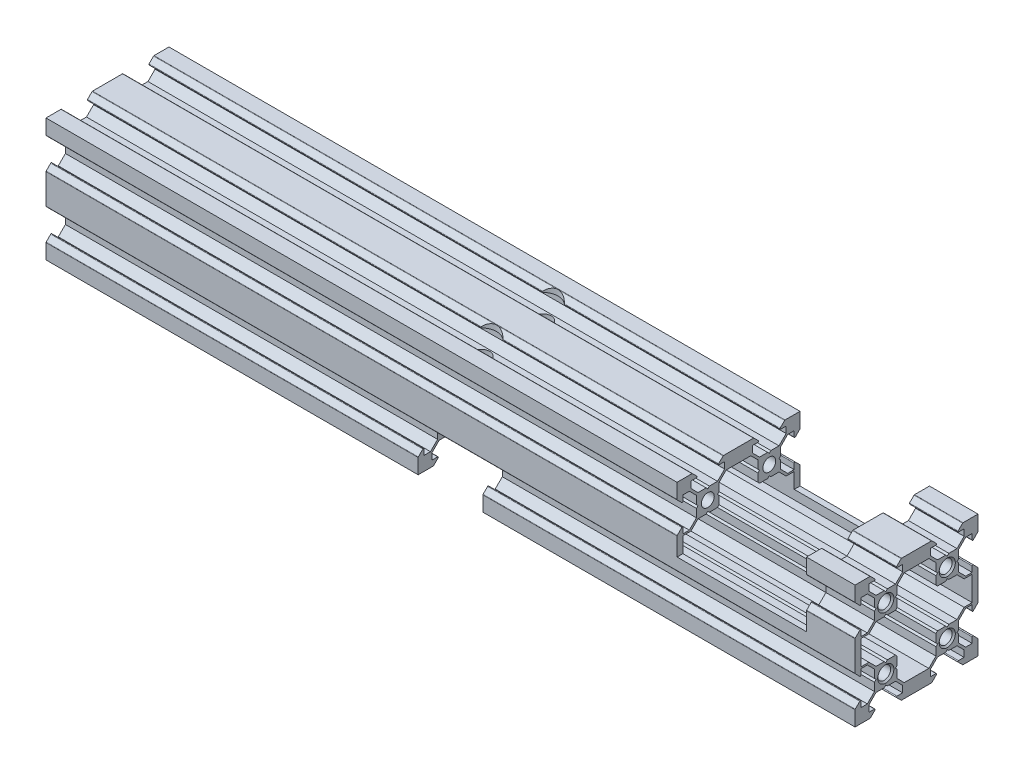
from build123d import *

# Parameters (mm, degrees)
MAIN_BODY_DEPTH               = 125
MAIN_BODY_DEPTH_BACK          = 125
SKETCH2_R                     = 2
CHAMFER1_SIZE                 = 0.5
CHAMFER2_SIZE                 = 0.5
CHAMFER3_SIZE                 = 0.5
TOP_HOLES_DEPTH               = 132.336275853
TOP_HOLES_DEPTH_BACK          = 132.336275853
SKETCH5_R                     = 2.6
TOP_HOLE_CLEARANCE_DEPTH      = 134.71932335
TOP_HOLE_CLEARANCE_DEPTH_BACK = 3
SKETCH6_R                     = 4.75
CUT_EXTRUDE5_DEPTH            = 132.336275948
CUT_EXTRUDE5_DEPTH_BACK       = 132.336275948
SKETCH7_W                     = 20
SKETCH7_H                     = 9.499173517
SKETCH7_W_2                   = 40
SKETCH7_H_2                   = 20


with BuildPart() as part:
    # Sketch2 → Main Body (new, two sides: drawn at the far end of the back side and taken through both)
    with BuildSketch(Plane(origin=(0, 0, 0), x_dir=(0, 0, -1), z_dir=(1, 0, 0)).offset(-MAIN_BODY_DEPTH_BACK)):
        with BuildLine():
            Line((0.5, 3.5), (0, 3))
            Line((0, 3), (-0.5, 3.5))
            Line((-0.5, 3.5), (-3.01, 3.5))
            Line((-3.01, 3.5), (-5.209102089, 5.699102089))
            Line((-5.209102089, 5.699102089), (-5.209102089, 7.699102089))
            Line((-5.209102089, 7.699102089), (-3.479102089, 7.699102089))
            ThreePointArc((-3.479102089, 7.699102089), (-3.294326183, 7.822565403), (-3.337680733, 8.040523446))
            Line((-3.337680733, 8.040523446), (-4.73775216, 9.440594872))
            ThreePointArc((-4.73775216, 9.440594872), (-4.80263683, 9.483949423), (-4.879173516, 9.499173516))
            Line((-4.879173516, 9.499173516), (-9.499173516, 9.499173516))
            Line((-9.499173516, 9.499173516), (-9.499173516, 4.879173516))
            ThreePointArc((-9.499173516, 4.879173516), (-9.483949423, 4.80263683), (-9.440594872, 4.73775216))
            Line((-9.440594872, 4.73775216), (-8.040523446, 3.337680733))
            ThreePointArc((-8.040523446, 3.337680733), (-7.822565403, 3.294326183), (-7.699102089, 3.479102089))
            Line((-7.699102089, 3.479102089), (-7.699102089, 5.209102089))
            Line((-7.699102089, 5.209102089), (-5.699102089, 5.209102089))
            Line((-5.699102089, 5.209102089), (-3.5, 3.01))
            Line((-3.5, 3.01), (-3.5, 0.5))
            Line((-3.5, 0.5), (-3, 0))
            Line((-3, 0), (-3.5, -0.5))
            Line((-3.5, -0.5), (-3.5, -3.01))
            Line((-3.5, -3.01), (-5.699102089, -5.209102089))
            Line((-5.699102089, -5.209102089), (-7.699102089, -5.209102089))
            Line((-7.699102089, -5.209102089), (-7.699102089, -3.479102089))
            ThreePointArc((-7.699102089, -3.479102089), (-7.822565403, -3.294326183), (-8.040523446, -3.337680733))
            Line((-8.040523446, -3.337680733), (-9.440594872, -4.73775216))
            ThreePointArc((-9.440594872, -4.73775216), (-9.483949423, -4.80263683), (-9.499173516, -4.879173516))
            Line((-9.499173516, -4.879173516), (-9.499173516, -14.119173516))
            ThreePointArc((-9.499173516, -14.119173516), (-9.483949423, -14.195710203), (-9.440594872, -14.260594872))
            Line((-9.440594872, -14.260594872), (-8.040523446, -15.660666299))
            ThreePointArc((-8.040523446, -15.660666299), (-7.822565403, -15.704020849), (-7.699102089, -15.519244943))
            Line((-7.699102089, -15.519244943), (-7.699102089, -13.789244943))
            Line((-7.699102089, -13.789244943), (-5.699102089, -13.789244943))
            Line((-5.699102089, -13.789244943), (-3.5, -15.988347032))
            Line((-3.5, -15.988347032), (-3.5, -18.498347032))
            Line((-3.5, -18.498347032), (-3, -18.998347032))
            Line((-3, -18.998347032), (-3.5, -19.498347032))
            Line((-3.5, -19.498347032), (-3.5, -22.008347032))
            Line((-3.5, -22.008347032), (-5.699102089, -24.207449122))
            Line((-5.699102089, -24.207449122), (-7.699102089, -24.207449122))
            Line((-7.699102089, -24.207449122), (-7.699102089, -22.477449122))
            ThreePointArc((-7.699102089, -22.477449122), (-7.822565403, -22.292673215), (-8.040523446, -22.336027766))
            Line((-8.040523446, -22.336027766), (-9.440594872, -23.736099192))
            ThreePointArc((-9.440594872, -23.736099192), (-9.483949423, -23.800983862), (-9.499173516, -23.877520549))
            Line((-9.499173516, -23.877520549), (-9.499173516, -28.497520549))
            Line((-9.499173516, -28.497520549), (-4.879173516, -28.497520549))
            ThreePointArc((-4.879173516, -28.497520549), (-4.80263683, -28.482296455), (-4.73775216, -28.438941905))
            Line((-4.73775216, -28.438941905), (-3.337680733, -27.038870478))
            ThreePointArc((-3.337680733, -27.038870478), (-3.294326183, -26.820912435), (-3.479102089, -26.697449122))
            Line((-3.479102089, -26.697449122), (-5.209102089, -26.697449122))
            Line((-5.209102089, -26.697449122), (-5.209102089, -24.697449122))
            Line((-5.209102089, -24.697449122), (-3.01, -22.498347032))
            Line((-3.01, -22.498347032), (-0.5, -22.498347032))
            Line((-0.5, -22.498347032), (0, -21.998347032))
            Line((0, -21.998347032), (0.5, -22.498347032))
            Line((0.5, -22.498347032), (3.01, -22.498347032))
            Line((3.01, -22.498347032), (5.209102089, -24.697449122))
            Line((5.209102089, -24.697449122), (5.209102089, -26.697449122))
            Line((5.209102089, -26.697449122), (3.479102089, -26.697449122))
            ThreePointArc((3.479102089, -26.697449122), (3.294326183, -26.820912435), (3.337680733, -27.038870478))
            Line((3.337680733, -27.038870478), (4.73775216, -28.438941905))
            ThreePointArc((4.73775216, -28.438941905), (4.80263683, -28.482296455), (4.879173516, -28.497520549))
            Line((4.879173516, -28.497520549), (14.119173516, -28.497520549))
            ThreePointArc((14.119173516, -28.497520549), (14.195710203, -28.482296455), (14.260594872, -28.438941905))
            Line((14.260594872, -28.438941905), (15.660666299, -27.038870478))
            ThreePointArc((15.660666299, -27.038870478), (15.704020849, -26.820912435), (15.519244943, -26.697449122))
            Line((15.519244943, -26.697449122), (13.789244943, -26.697449122))
            Line((13.789244943, -26.697449122), (13.789244943, -24.697449122))
            Line((13.789244943, -24.697449122), (15.988347032, -22.498347032))
            Line((15.988347032, -22.498347032), (18.498347032, -22.498347032))
            Line((18.498347032, -22.498347032), (18.998347032, -21.998347032))
            Line((18.998347032, -21.998347032), (19.498347032, -22.498347032))
            Line((19.498347032, -22.498347032), (22.008347032, -22.498347032))
            Line((22.008347032, -22.498347032), (24.207449122, -24.697449122))
            Line((24.207449122, -24.697449122), (24.207449122, -26.697449122))
            Line((24.207449122, -26.697449122), (22.477449122, -26.697449122))
            ThreePointArc((22.477449122, -26.697449122), (22.292673215, -26.820912435), (22.336027766, -27.038870478))
            Line((22.336027766, -27.038870478), (23.736099192, -28.438941905))
            ThreePointArc((23.736099192, -28.438941905), (23.800983862, -28.482296455), (23.877520549, -28.497520549))
            Line((23.877520549, -28.497520549), (28.497520549, -28.497520549))
            Line((28.497520549, -28.497520549), (28.497520549, -23.877520549))
            ThreePointArc((28.497520549, -23.877520549), (28.482296455, -23.800983862), (28.438941905, -23.736099192))
            Line((28.438941905, -23.736099192), (27.038870478, -22.336027766))
            ThreePointArc((27.038870478, -22.336027766), (26.820912435, -22.292673215), (26.697449122, -22.477449122))
            Line((26.697449122, -22.477449122), (26.697449122, -24.207449122))
            Line((26.697449122, -24.207449122), (24.697449122, -24.207449122))
            Line((24.697449122, -24.207449122), (22.498347032, -22.008347032))
            Line((22.498347032, -22.008347032), (22.498347032, -19.498347032))
            Line((22.498347032, -19.498347032), (21.998347032, -18.998347032))
            Line((21.998347032, -18.998347032), (22.498347032, -18.498347032))
            Line((22.498347032, -18.498347032), (22.498347032, -15.988347032))
            Line((22.498347032, -15.988347032), (24.697449122, -13.789244943))
            Line((24.697449122, -13.789244943), (26.697449122, -13.789244943))
            Line((26.697449122, -13.789244943), (26.697449122, -15.519244943))
            ThreePointArc((26.697449122, -15.519244943), (26.820912435, -15.704020849), (27.038870478, -15.660666299))
            Line((27.038870478, -15.660666299), (28.438941905, -14.260594872))
            ThreePointArc((28.438941905, -14.260594872), (28.482296455, -14.195710203), (28.497520549, -14.119173516))
            Line((28.497520549, -14.119173516), (28.497520549, -4.879173516))
            ThreePointArc((28.497520549, -4.879173516), (28.482296455, -4.80263683), (28.438941905, -4.73775216))
            Line((28.438941905, -4.73775216), (27.038870478, -3.337680733))
            ThreePointArc((27.038870478, -3.337680733), (26.820912435, -3.294326183), (26.697449122, -3.479102089))
            Line((26.697449122, -3.479102089), (26.697449122, -5.209102089))
            Line((26.697449122, -5.209102089), (24.697449122, -5.209102089))
            Line((24.697449122, -5.209102089), (22.498347032, -3.01))
            Line((22.498347032, -3.01), (22.498347032, -0.5))
            Line((22.498347032, -0.5), (21.998347032, 0))
            Line((21.998347032, 0), (22.498347032, 0.5))
            Line((22.498347032, 0.5), (22.498347032, 3.01))
            Line((22.498347032, 3.01), (24.697449122, 5.209102089))
            Line((24.697449122, 5.209102089), (26.697449122, 5.209102089))
            Line((26.697449122, 5.209102089), (26.697449122, 3.479102089))
            ThreePointArc((26.697449122, 3.479102089), (26.820912435, 3.294326183), (27.038870478, 3.337680733))
            Line((27.038870478, 3.337680733), (28.438941905, 4.73775216))
            ThreePointArc((28.438941905, 4.73775216), (28.482296455, 4.80263683), (28.497520549, 4.879173516))
            Line((28.497520549, 4.879173516), (28.497520549, 9.499173516))
            Line((28.497520549, 9.499173516), (23.877520549, 9.499173516))
            ThreePointArc((23.877520549, 9.499173516), (23.800983862, 9.483949423), (23.736099192, 9.440594872))
            Line((23.736099192, 9.440594872), (22.336027766, 8.040523446))
            ThreePointArc((22.336027766, 8.040523446), (22.292673215, 7.822565403), (22.477449122, 7.699102089))
            Line((22.477449122, 7.699102089), (24.207449122, 7.699102089))
            Line((24.207449122, 7.699102089), (24.207449122, 5.699102089))
            Line((24.207449122, 5.699102089), (22.008347032, 3.5))
            Line((22.008347032, 3.5), (19.498347032, 3.5))
            Line((19.498347032, 3.5), (18.998347032, 3))
            Line((18.998347032, 3), (18.498347032, 3.5))
            Line((18.498347032, 3.5), (15.988347032, 3.5))
            Line((15.988347032, 3.5), (13.789244943, 5.699102089))
            Line((13.789244943, 5.699102089), (13.789244943, 7.699102089))
            Line((13.789244943, 7.699102089), (15.519244943, 7.699102089))
            ThreePointArc((15.519244943, 7.699102089), (15.704020849, 7.822565403), (15.660666299, 8.040523446))
            Line((15.660666299, 8.040523446), (14.260594872, 9.440594872))
            ThreePointArc((14.260594872, 9.440594872), (14.195710203, 9.483949423), (14.119173516, 9.499173516))
            Line((14.119173516, 9.499173516), (4.879173516, 9.499173516))
            ThreePointArc((4.879173516, 9.499173516), (4.80263683, 9.483949423), (4.73775216, 9.440594872))
            Line((4.73775216, 9.440594872), (3.337680733, 8.040523446))
            ThreePointArc((3.337680733, 8.040523446), (3.294326183, 7.822565403), (3.479102089, 7.699102089))
            Line((3.479102089, 7.699102089), (5.209102089, 7.699102089))
            Line((5.209102089, 7.699102089), (5.209102089, 5.699102089))
            Line((5.209102089, 5.699102089), (3.01, 3.5))
            Line((3.01, 3.5), (0.5, 3.5))
        make_face()
        with Locations((0, -18.998347032)):
            Circle(SKETCH2_R, mode=Mode.SUBTRACT)
        with Locations((18.998347032, -18.998347032)):
            Circle(SKETCH2_R, mode=Mode.SUBTRACT)
        Polygon((3.5, -0.5), (3, 0), (3.5, 0.5), (3.5, 3.01), (5.699102089, 5.209102089), (7.699102089, 5.209102089), (11.299244943, 5.209102089), (13.299244943, 5.209102089), (15.498347032, 3.01), (15.498347032, 0.5), (15.998347032, 0), (15.498347032, -0.5), (15.498347032, -3.01), (15.988347032, -3.5), (18.498347032, -3.5), (18.998347032, -3), (19.498347032, -3.5), (22.008347032, -3.5), (24.207449122, -5.699102089), (26.697449122, -5.699102089), (26.697449122, -13.299244943), (24.207449122, -13.299244943), (22.008347032, -15.498347032), (19.498347032, -15.498347032), (18.998347032, -15.998347032), (18.498347032, -15.498347032), (15.988347032, -15.498347032), (15.498347032, -15.988347032), (15.498347032, -18.498347032), (15.998347032, -18.998347032), (15.498347032, -19.498347032), (15.498347032, -22.008347032), (13.299244943, -24.207449122), (11.299244943, -24.207449122), (7.699102089, -24.207449122), (5.699102089, -24.207449122), (3.5, -22.008347032), (3.5, -19.498347032), (3, -18.998347032), (3.5, -18.498347032), (3.5, -15.988347032), (3.01, -15.498347032), (0.5, -15.498347032), (0, -15.998347032), (-0.5, -15.498347032), (-3.01, -15.498347032), (-5.209102089, -13.299244943), (-7.699102089, -13.299244943), (-7.699102089, -5.699102089), (-5.209102089, -5.699102089), (-3.01, -3.5), (-0.5, -3.5), (0, -3), (0.5, -3.5), (3.01, -3.5), (3.5, -3.01), align=None, mode=Mode.SUBTRACT)
        Circle(SKETCH2_R, mode=Mode.SUBTRACT)
        with Locations((18.998347032, 0)):
            Circle(SKETCH2_R, mode=Mode.SUBTRACT)
    extrude(amount=MAIN_BODY_DEPTH + MAIN_BODY_DEPTH_BACK)

    # Chamfer1
    chamfer1_edges = [part.edges().sort_by_distance(p)[0] for p in [
        (125, 0, 2),
    ]]
    chamfer(chamfer1_edges, length=CHAMFER1_SIZE)

    # Chamfer2
    chamfer2_edges = [part.edges().sort_by_distance(p)[0] for p in [
        (-125, 0, 2),
    ]]
    chamfer(chamfer2_edges, length=CHAMFER2_SIZE)

    # Chamfer3
    chamfer3_edges = [part.edges().sort_by_distance(p)[0] for p in [
        (-125, -18.998347032, 2),
        (-125, -18.998347032, -16.998347032),
        (-125, 0, -16.998347032),
        (125, -18.998347032, 2),
        (125, -18.998347032, -16.998347032),
        (125, 0, -16.998347032),
    ]]
    chamfer(chamfer3_edges, length=CHAMFER3_SIZE)

    # Sketch5 → Top Holes (cut, two sides: drawn at the far end of the back side and taken through both)
    with BuildSketch(Plane(origin=(0, 0, 0), x_dir=(1, 0, 0), z_dir=(0, 1, 0)).offset(-TOP_HOLES_DEPTH_BACK)):
        with Locations((0, 18.998347032)):
            Circle(SKETCH5_R)
        Circle(SKETCH5_R)
    extrude(amount=TOP_HOLES_DEPTH + TOP_HOLES_DEPTH_BACK, mode=Mode.SUBTRACT)

    # Sketch6 → Top Hole Clearance (cut, two sides: drawn at the far end of the back side and taken through both)
    with BuildSketch(Plane(origin=(0, 9.499173516, 0), x_dir=(1, 0, 0), z_dir=(0, 1, 0)).offset(-TOP_HOLE_CLEARANCE_DEPTH_BACK)):
        with Locations((0, 18.998347032)):
            Circle(SKETCH6_R)
        Circle(SKETCH6_R)
    extrude(amount=TOP_HOLE_CLEARANCE_DEPTH + TOP_HOLE_CLEARANCE_DEPTH_BACK, mode=Mode.SUBTRACT)

    # Sketch7 → Cut-Extrude5 (cut, two sides: drawn at the far end of the back side and taken through both)
    with BuildSketch(Plane.XY.offset(-CUT_EXTRUDE5_DEPTH_BACK)):
        with Locations((0, -23.74793379)):
            Rectangle(SKETCH7_W, SKETCH7_H)
        with Locations((90, -0.500826484)):
            Rectangle(SKETCH7_W_2, SKETCH7_H_2)
    extrude(amount=CUT_EXTRUDE5_DEPTH + CUT_EXTRUDE5_DEPTH_BACK, mode=Mode.SUBTRACT)


solid = part.part
